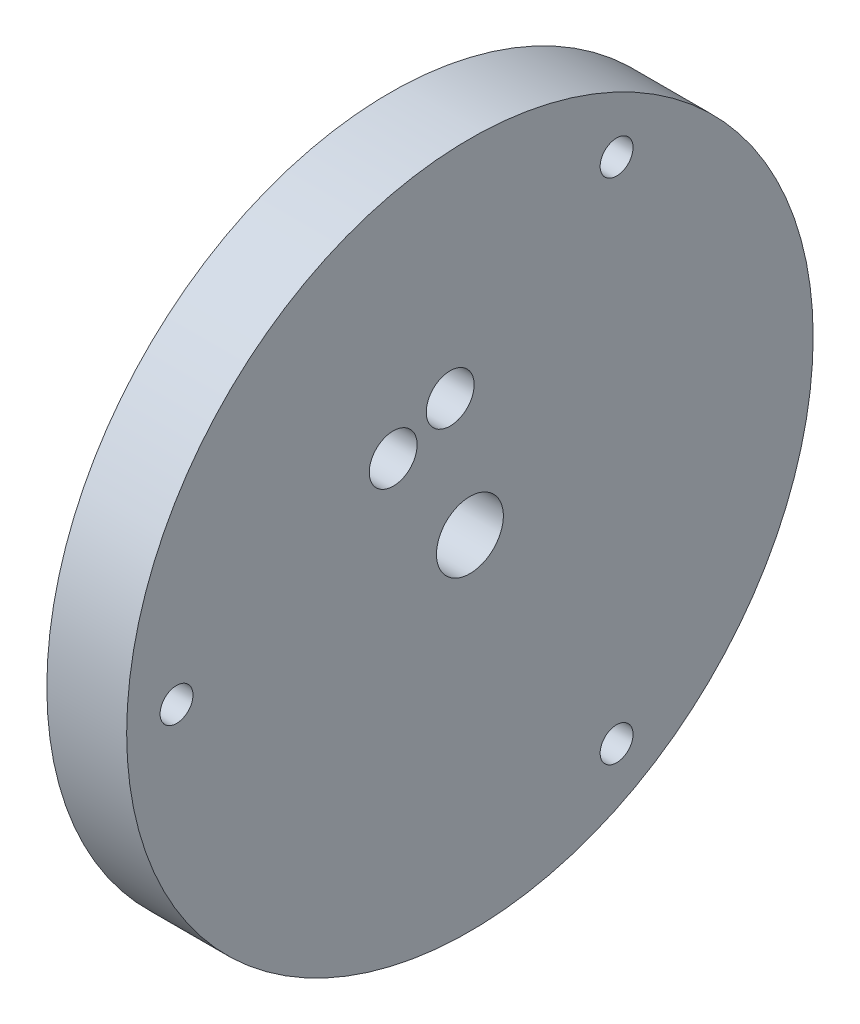
from build123d import *

# Parameters (mm, degrees)
AXIAL_PROFILE_MM_W     = 8
AXIAL_PROFILE_MM_H     = 31.05
AXIAL_HOLES_DEPTH      = 165.078060691
AXIAL_HOLES_DEPTH_BACK = 165.078060691
SKETCH2_R              = 2.4
SKETCH2_R_2            = 1.65
CUT_EXTRUDE2_START     = 148.7
SKETCH3_R              = 1.25
CUT_EXTRUDE2_DEPTH     = 6


with BuildPart() as part:
    # Axial profile (mm) → Full revolution (revolve)
    with BuildSketch(Plane.XY, mode=Mode.PRIVATE) as full_revolution_sk:
        with Locations((152.7, 18.875)):
            Rectangle(AXIAL_PROFILE_MM_W, AXIAL_PROFILE_MM_H)
    revolve(full_revolution_sk.sketch.rotate(Axis((-110, 0, 0), (1, 0, 0)), 90), axis=Axis((-110, 0, 0), (1, 0, 0)))

    # Sketch2 → Axial holes (cut, two sides: drawn at the far end of the back side and taken through both)
    with BuildSketch(Plane(origin=(0, 0, 0), x_dir=(0, 0, -1), z_dir=(1, 0, 0)).offset(-AXIAL_HOLES_DEPTH_BACK)):
        with Locations((-1.977382665, 12.848733704)):
            Circle(SKETCH2_R)
        with Locations((-7.687206041, 10.483647423)):
            Circle(SKETCH2_R)
        with Locations((-29.4, 0)):
            Circle(SKETCH2_R_2)
        with Locations((14.7, -25.461146871)):
            Circle(SKETCH2_R_2)
        with Locations((14.7, 25.461146871)):
            Circle(SKETCH2_R_2)
    extrude(amount=AXIAL_HOLES_DEPTH + AXIAL_HOLES_DEPTH_BACK, mode=Mode.SUBTRACT)

    # Sketch3 → Cut-Extrude2 (cut)
    with BuildSketch(Plane(origin=(0, 0, 0), x_dir=(0, 0, -1), z_dir=(1, 0, 0)).offset(CUT_EXTRUDE2_START)):
        with Locations((-12, 0)):
            Circle(SKETCH3_R)
        with Locations((6, -10.392304845)):
            Circle(SKETCH3_R)
        with Locations((6, 10.392304845)):
            Circle(SKETCH3_R)
    extrude(amount=CUT_EXTRUDE2_DEPTH, mode=Mode.SUBTRACT)


solid = part.part
